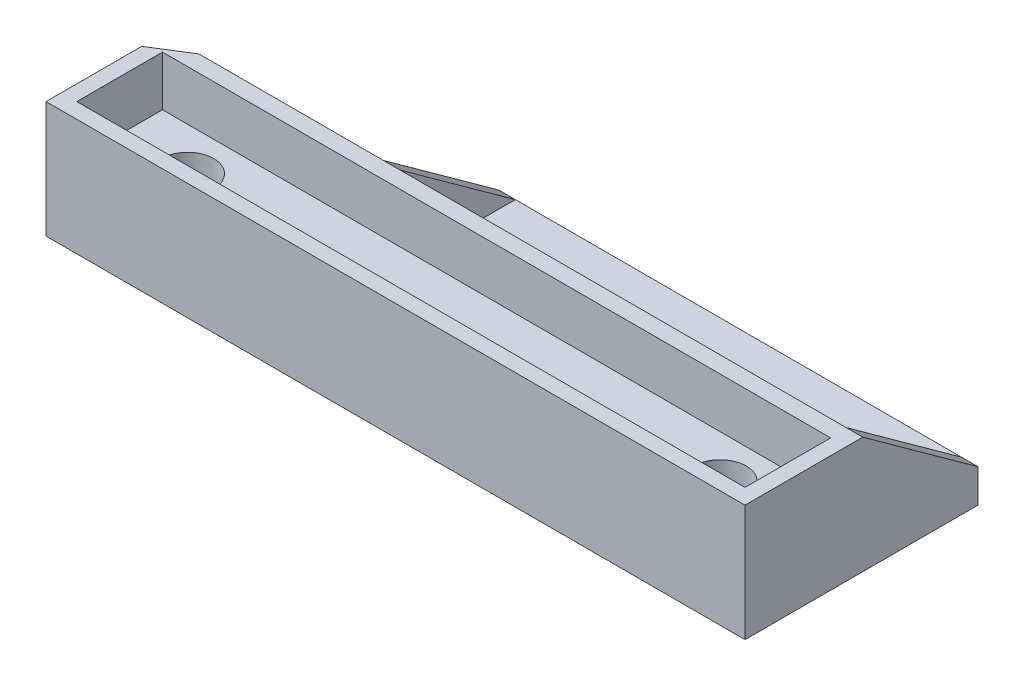
from build123d import *

# Parameters (mm, degrees)
RISER_DEPTH             = 7
SKETCH2_R               = 1.575
MOUNTING_HOLES_DEPTH    = 44.150898021
SKETCH3_W               = 40.15
SKETCH3_H               = 5.15
RECESS_DEPTH            = 3
FLANGE_DEPTH            = 7
SKETCH5_W               = 26.797240136
SKETCH5_H               = 6.925
FLANGE_CUTOUT_DEPTH     = 5
ANGLE_CUTOUT_DEPTH      = 44.886216515
ANGLE_CUTOUT_DEPTH_BACK = 44.886216515
FLANGE_CHAMFER_1_SIZE   = 1
FLANGE_CHAMFER_2_SIZE   = 1


with BuildPart() as part:
    # Sketch1 → Riser (new body)
    with BuildSketch(Plane(origin=(0, 0, 0), x_dir=(1, 0, 0), z_dir=(0, 1, 0))):
        Polygon((2.000418161, 7), (42, 7), (42, 0), (0, 0), (0, 5.75), align=None)
    extrude(amount=RISER_DEPTH)

    # Sketch2 → Mounting Holes (cut, through all)
    with BuildSketch(Plane.XZ):
        with Locations(Location((37, -3.5, 0), (0, 0, 270))):
            Circle(SKETCH2_R)
        with Locations(Location((5, -3.5, 0), (0, 0, 90))):
            Circle(SKETCH2_R)
    extrude(amount=-MOUNTING_HOLES_DEPTH, mode=Mode.SUBTRACT)

    # Sketch3 → Recess (cut)
    with BuildSketch(Plane(origin=(0, 7, 0), x_dir=(1, 0, 0), z_dir=(0, 1, 0))):
        with Locations((21, 3.5)):
            Rectangle(SKETCH3_W, SKETCH3_H)
    extrude(amount=-RECESS_DEPTH, mode=Mode.SUBTRACT)

    # Sketch4 → Flange (add)
    with BuildSketch(Plane(origin=(0, 0, 0), x_dir=(1, 0, 0), z_dir=(0, 1, 0))):
        Polygon((2.000418161, 7), (42, 7), (42, 14), (13.202759864, 14), align=None)
    extrude(amount=FLANGE_DEPTH)

    # Sketch5 → Flange Cutout (cut)
    with BuildSketch(Plane(origin=(0, 7, 0), x_dir=(1, 0, 0), z_dir=(0, 1, 0))):
        with Locations((27.601379932, 10.5375)):
            Rectangle(SKETCH5_W, SKETCH5_H)
        Polygon((2.120443251, 7.075), (13.202759864, 7.075), (13.202759864, 14), align=None)
    extrude(amount=-FLANGE_CUTOUT_DEPTH, mode=Mode.SUBTRACT)

    # Sketch7 → Angle Cutout (cut, two sides: drawn at the far end of the back side and taken through both)
    with BuildSketch(Plane.ZY.offset(-41).offset(-ANGLE_CUTOUT_DEPTH_BACK)):
        Polygon((-7.075, 7), (-14, 2), (-14, 7), align=None)
    extrude(amount=ANGLE_CUTOUT_DEPTH + ANGLE_CUTOUT_DEPTH_BACK, mode=Mode.SUBTRACT)

    # Flange Chamfer 1
    flange_chamfer_1_edges = [part.edges().sort_by_distance(p)[0] for p in [
        (27.601379932, 2, -7.075),
    ]]
    chamfer(flange_chamfer_1_edges, length=FLANGE_CHAMFER_1_SIZE)

    # Flange Chamfer 2
    flange_chamfer_2_edges = [part.edges().sort_by_distance(p)[0] for p in [
        (7.661601558, 2, -7.075),
    ]]
    chamfer(flange_chamfer_2_edges, length=FLANGE_CHAMFER_2_SIZE)


solid = part.part
